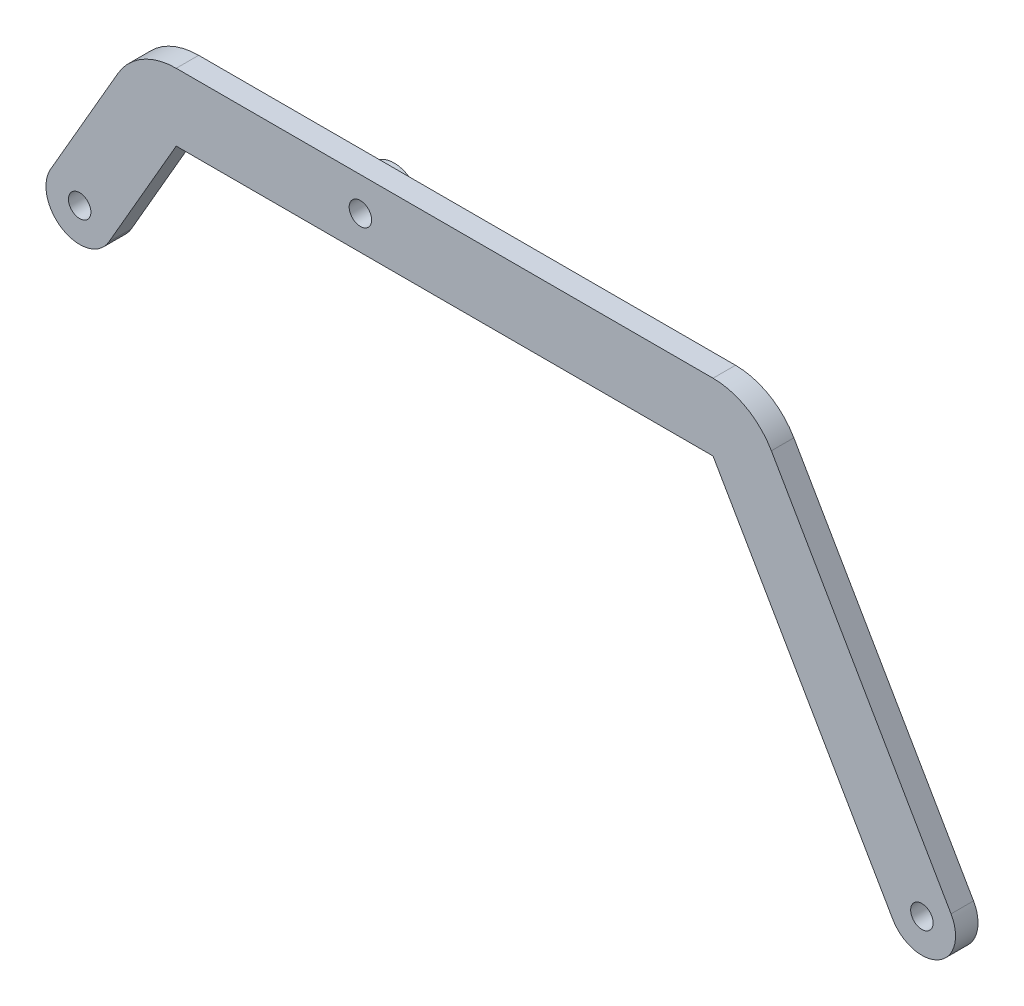
from build123d import *

# Parameters (mm, degrees)
BOSS_EXTRUDE1_DEPTH = 10
SKETCH2_R           = 5
CUT_EXTRUDE1_DEPTH  = 10
SKETCH3_R           = 12
BOSS_EXTRUDE2_DEPTH = 5


with BuildPart() as part:
    # Sketch1 → Boss-Extrude1 (new body)
    with BuildSketch(Plane.XY):
        with BuildLine():
            Line((-82.009618943, -15), (-112.009618943, -66.961524227))
            ThreePointArc((-112.009618943, -66.961524227), (-132.5, -72.451905284), (-137.990381057, -51.961524227))
            Line((-137.990381057, -51.961524227), (-107.990381057, 0))
            ThreePointArc((-107.990381057, 0), (-97.009618943, 10.980762114), (-82.009618943, 15))
            Line((-82.009618943, 15), (0, 15))
            Line((0, 15), (157.009618943, 15))
            ThreePointArc((157.009618943, 15), (172.009618943, 10.980762114), (182.990381057, 0))
            Line((182.990381057, 0), (262.990381057, -138.564064606))
            ThreePointArc((262.990381057, -138.564064606), (257.5, -159.054445662), (237.009618943, -153.564064606))
            Line((237.009618943, -153.564064606), (157.009618943, -15))
            Line((157.009618943, -15), (0, -15))
            Line((0, -15), (-82.009618943, -15))
        make_face()
    extrude(amount=BOSS_EXTRUDE1_DEPTH)

    # Sketch2 → Cut-Extrude1 (cut)
    with BuildSketch(Plane.XY.offset(10)):
        with Locations((-125, -59.461524227)):
            Circle(SKETCH2_R)
        with Locations((250, -146.064064606)):
            Circle(SKETCH2_R)
        Circle(SKETCH2_R)
    extrude(amount=-CUT_EXTRUDE1_DEPTH, mode=Mode.SUBTRACT)

    # Sketch3 → Boss-Extrude2 (add)
    with BuildSketch(Plane(origin=(0, 0, 0), x_dir=(-1, 0, 0), z_dir=(0, 0, -1))):
        Circle(SKETCH3_R)
    extrude(amount=BOSS_EXTRUDE2_DEPTH)


solid = part.part
